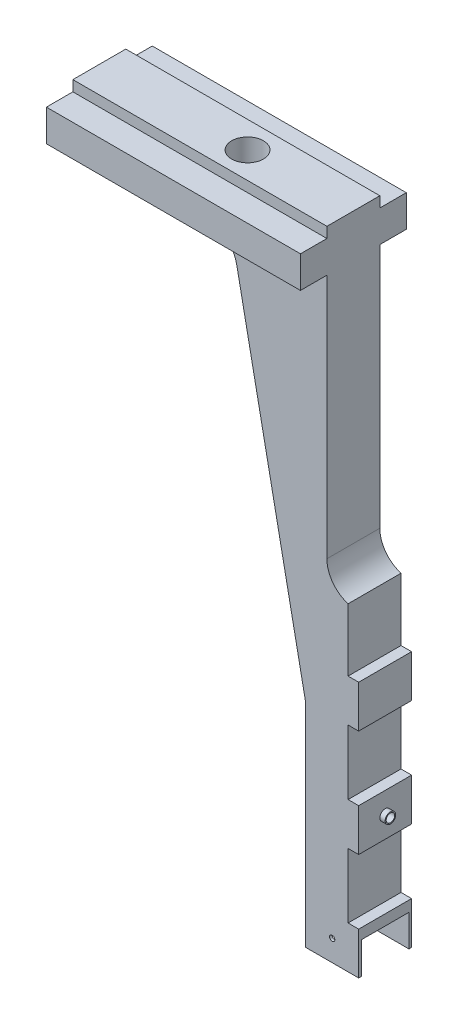
from build123d import *

# Parameters (mm, degrees)
BOSS_EXTRUDE1_DEPTH = 5
FILLET1_R           = 3
SKETCH2_W           = 24
SKETCH2_H           = 3
BOSS_EXTRUDE2_DEPTH = 2.5
SKETCH3_W           = 24
SKETCH3_H           = 3
BOSS_EXTRUDE3_DEPTH = 2.5
SKETCH4_W           = 5
SKETCH4_H           = 6.1
CUT_EXTRUDE1_DEPTH  = 1
SKETCH5_R           = 1.5
CUT_EXTRUDE2_DEPTH  = 14
SKETCH7_R           = 0.25
CUT_EXTRUDE3_DEPTH  = 10
SKETCH8_W           = 4.5
SKETCH8_H           = 3
CUT_EXTRUDE4_DEPTH  = 5
SKETCH12_R          = 0.5
BOSS_EXTRUDE4_DEPTH = 0.5
SKETCH13_R          = 0.4
CUT_EXTRUDE5_DEPTH  = 3.5


with BuildPart() as part:
    # Sketch1 → Boss-Extrude1 (new body)
    with BuildSketch(Plane.XY):
        with BuildLine():
            Line((0, -60), (-5, -60))
            Line((-5, -60), (-5, -40))
            Line((-5, -40), (-12, -5))
            Line((-12, -5), (-27, -5))
            Line((-27, -5), (-27, 0))
            Line((-27, 0), (-3, 0))
            Line((-3, 0), (-3, -27.2))
            ThreePointArc((-3, -27.2), (-2.179898987, -29.179898987), (-0.2, -30))
            Line((-0.2, -30), (0, -30))
            Line((0, -30), (0, -60))
        make_face()
    extrude(amount=BOSS_EXTRUDE1_DEPTH)

    # Fillet1
    fillet1_edges = [part.edges().sort_by_distance(p)[0] for p in [
        (-5, -40, 2.5),
        (-12, -5, 2.5),
    ]]
    fillet(fillet1_edges, radius=FILLET1_R)

    # Sketch2 → Boss-Extrude2 (add)
    with BuildSketch(Plane.XY.offset(5)):
        with Locations((-15, -2.5)):
            Rectangle(SKETCH2_W, SKETCH2_H)
    extrude(amount=BOSS_EXTRUDE2_DEPTH)

    # Sketch3 → Boss-Extrude3 (add)
    with BuildSketch(Plane(origin=(0, 0, 0), x_dir=(-1, 0, 0), z_dir=(0, 0, -1))):
        with Locations((15, -2.5)):
            Rectangle(SKETCH3_W, SKETCH3_H)
    extrude(amount=BOSS_EXTRUDE3_DEPTH)

    # Sketch4 → Cut-Extrude1 (cut)
    with BuildSketch(Plane(origin=(0, 0, 0), x_dir=(0, 0, -1), z_dir=(1, 0, 0))):
        with Locations((-2.5, -52.95)):
            Rectangle(SKETCH4_W, SKETCH4_H)
        with Locations((-2.5, -42.85)):
            Rectangle(SKETCH4_W, SKETCH4_H)
        with Locations((-2.5, -32.75)):
            Rectangle(SKETCH4_W, SKETCH4_H)
        with Locations((-2.5, -22.65)):
            Rectangle(SKETCH4_W, SKETCH4_H)
        with Locations((-2.5, -12.55)):
            Rectangle(SKETCH4_W, SKETCH4_H)
        with Locations((-2.5, -2.45)):
            Rectangle(SKETCH4_W, SKETCH4_H)
    extrude(amount=-CUT_EXTRUDE1_DEPTH, mode=Mode.SUBTRACT)

    # Sketch5 → Cut-Extrude2 (cut)
    with BuildSketch(Plane(origin=(0, 0, 0), x_dir=(1, 0, 0), z_dir=(0, 1, 0))):
        with Locations(Location((-13, -2.5, 0), (0, 0, 180))):
            Circle(SKETCH5_R)
    extrude(amount=-CUT_EXTRUDE2_DEPTH, mode=Mode.SUBTRACT)

    # Sketch7 → Cut-Extrude3 (cut)
    with BuildSketch(Plane.XY.offset(5)):
        with Locations((-2.5, -58)):
            Circle(SKETCH7_R)
    extrude(amount=-CUT_EXTRUDE3_DEPTH, mode=Mode.SUBTRACT)

    # Sketch8 → Cut-Extrude4 (cut)
    with BuildSketch(Plane(origin=(0, 0, 0), x_dir=(0, 0, -1), z_dir=(1, 0, 0))):
        with Locations((-2.5, -58.5)):
            Rectangle(SKETCH8_W, SKETCH8_H)
    extrude(amount=-CUT_EXTRUDE4_DEPTH, mode=Mode.SUBTRACT)

    # Sketch12 → Boss-Extrude4 (add)
    with BuildSketch(Plane(origin=(0, 0, 0), x_dir=(0, 0, -1), z_dir=(1, 0, 0))):
        with Locations(Location((-2.5, -47.9, 0), (0, 0, 270))):
            Circle(SKETCH12_R)
    extrude(amount=BOSS_EXTRUDE4_DEPTH)

    # Sketch13 → Cut-Extrude5 (cut)
    with BuildSketch(Plane(origin=(0.5, 0, 0), x_dir=(0, 0, -1), z_dir=(1, 0, 0))):
        with Locations(Location((-2.5, -47.9, 0), (0, 0, 90))):
            Circle(SKETCH13_R)
    extrude(amount=-CUT_EXTRUDE5_DEPTH, mode=Mode.SUBTRACT)


solid = part.part
